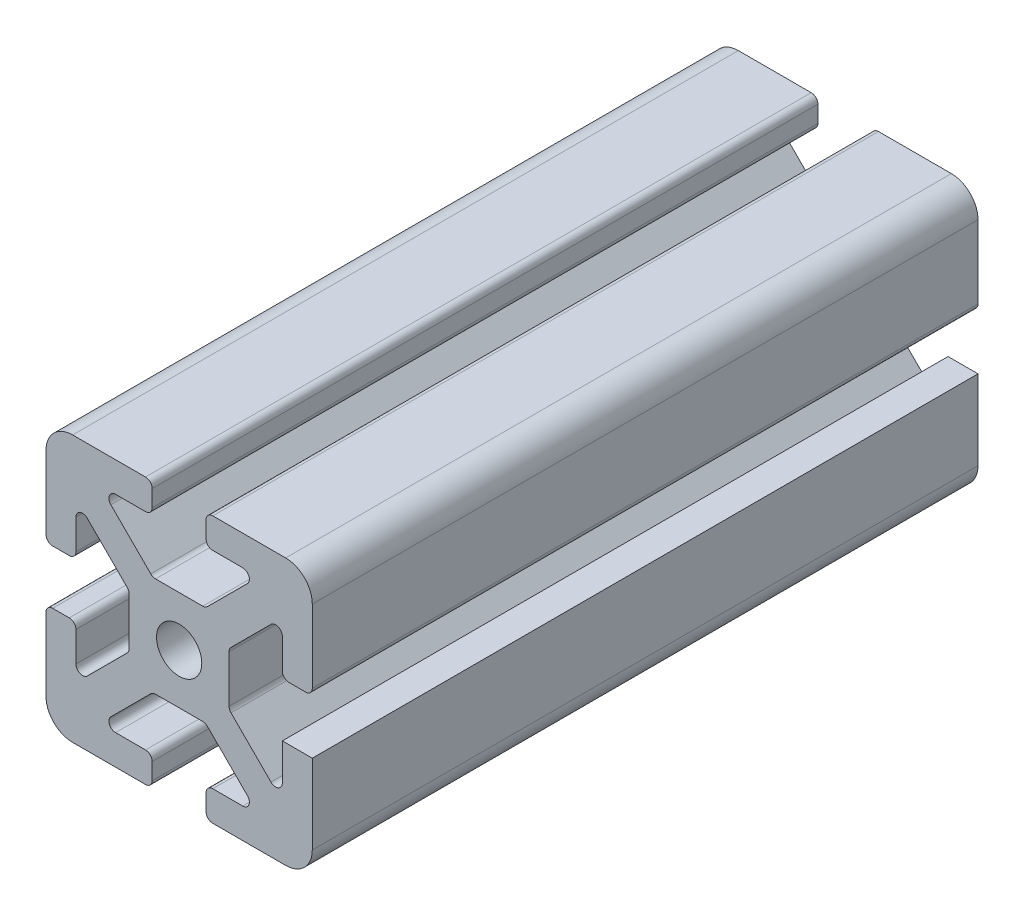
from build123d import *

# Parameters (mm, degrees)
SKIZZE1_R                       = 3.4
AUFSATZ_LINEAR_AUSTRAGEN1_DEPTH = 100
VERRUNDUNG1_R                   = 4
VERRUNDUNG2_R                   = 1


with BuildPart() as part:
    # Skizze1 → Aufsatz-Linear austragen1 (new body)
    with BuildSketch(Plane.XY):
        Polygon((-20, -20), (-4.05, -20), (-4.05, -15.5), (-11.964466094, -15.5), (-3.964466094, -7.5), (3.964466094, -7.5), (11.964466094, -15.5), (4.05, -15.5), (4.05, -20), (20, -20), (20, -4.05), (15.5, -4.05), (15.5, -11.964466094), (7.5, -3.964466094), (7.5, 3.964466094), (15.5, 11.964466094), (15.5, 4.05), (20, 4.05), (20, 20), (4.05, 20), (4.05, 15.5), (11.964466094, 15.5), (3.964466094, 7.5), (-3.964466094, 7.5), (-11.964466094, 15.5), (-4.05, 15.5), (-4.05, 20), (-20, 20), (-20, 4.05), (-15.5, 4.05), (-15.5, 11.964466094), (-7.5, 3.964466094), (-7.5, -3.964466094), (-15.5, -11.964466094), (-15.5, -4.05), (-20, -4.05), align=None)
        Circle(SKIZZE1_R, mode=Mode.SUBTRACT)
    extrude(amount=AUFSATZ_LINEAR_AUSTRAGEN1_DEPTH)

    # Verrundung1
    verrundung1_edges = [part.edges().sort_by_distance(p)[0] for p in [
        (20, -20, 50),
        (-20, -20, 50),
        (-20, 20, 50),
        (20, 20, 50),
    ]]
    fillet(verrundung1_edges, radius=VERRUNDUNG1_R)

    # Verrundung2
    verrundung2_edges = [part.edges().sort_by_distance(p)[0] for p in [
        (20, 4.05, 50),
        (15.5, 4.05, 50),
        (15.5, 11.964466094, 50),
        (7.5, 3.964466094, 50),
        (7.5, -3.964466094, 50),
        (15.5, -11.964466094, 50),
        (4.05, -20, 50),
        (4.05, -15.5, 50),
        (11.964466094, -15.5, 50),
        (3.964466094, -7.5, 50),
        (-3.964466094, -7.5, 50),
        (-11.964466094, -15.5, 50),
        (-4.05, -15.5, 50),
        (-4.05, -20, 50),
        (-20, -4.05, 50),
        (-15.5, -4.05, 50),
        (-15.5, -11.964466094, 50),
        (-7.5, -3.964466094, 50),
        (-7.5, 3.964466094, 50),
        (-15.5, 11.964466094, 50),
        (-15.5, 4.05, 50),
        (-20, 4.05, 50),
        (-4.05, 20, 50),
        (-4.05, 15.5, 50),
        (-11.964466094, 15.5, 50),
        (-3.964466094, 7.5, 50),
        (3.964466094, 7.5, 50),
        (11.964466094, 15.5, 50),
        (4.05, 15.5, 50),
        (4.05, 20, 50),
    ]]
    fillet(verrundung2_edges, radius=VERRUNDUNG2_R)


solid = part.part
